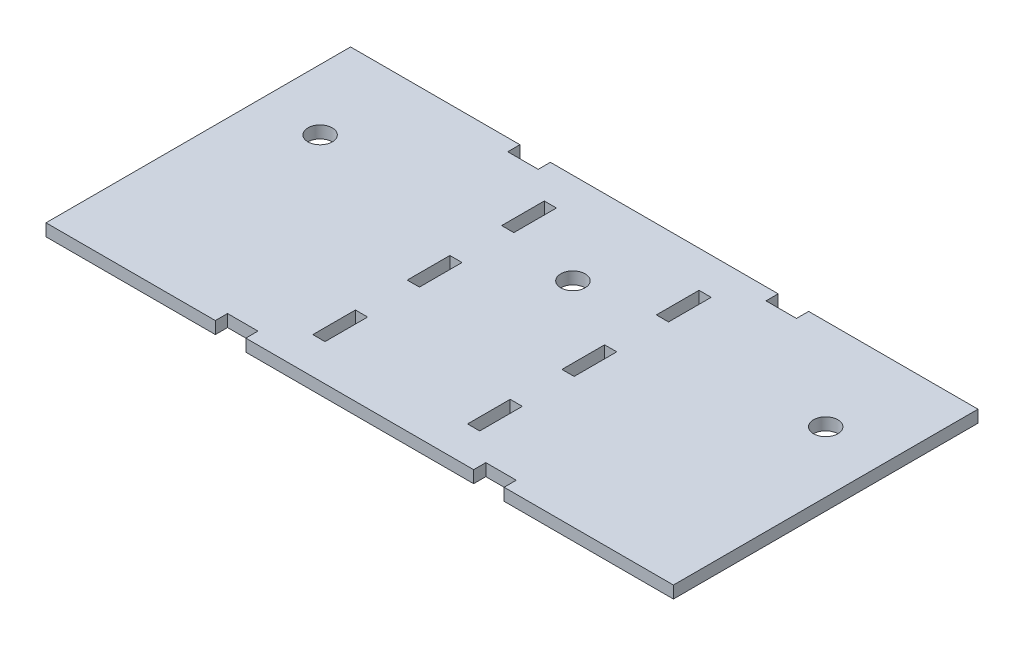
from build123d import *

# Parameters (mm, degrees)
SKETCH1_W           = 2
SKETCH1_H           = 7
SKETCH1_R           = 2
BOSS_EXTRUDE1_DEPTH = 2


with BuildPart() as part:
    # Sketch1 → Boss-Extrude1 (new body)
    with BuildSketch(Plane(origin=(0, 0, 0), x_dir=(1, 0, 0), z_dir=(0, 1, 0))):
        Polygon((-42.999453113, 2.019339096), (-70.799453113, 2.019339096), (-70.799453113, -47.980660904), (-42.999453113, -47.980660904), (-42.999453113, -45.980660904), (-37.999453113, -45.980660904), (-37.999453113, -47.980660904), (-0.599453113, -47.980660904), (-0.599453113, -45.980660904), (4.400546887, -45.980660904), (4.400546887, -47.980660904), (32.200546887, -47.980660904), (32.200546887, 2.019339096), (4.400546887, 2.019339096), (4.400546887, 0.019339096), (-0.599453113, 0.019339096), (-0.599453113, 2.019339096), (-37.999453113, 2.019339096), (-37.999453113, 0.019339096), (-42.999453113, 0.019339096), align=None)
        with Locations((-31.999453113, -38.480660904)):
            Rectangle(SKETCH1_W, SKETCH1_H, mode=Mode.SUBTRACT)
        with Locations((-6.599453113, -38.480660904)):
            Rectangle(SKETCH1_W, SKETCH1_H, mode=Mode.SUBTRACT)
        with Locations(Location((-60.799453113, -12.980660904, 0), (0, 0, 270))):
            Circle(SKETCH1_R, mode=Mode.SUBTRACT)
        with Locations((-31.999453113, -22.980660904)):
            Rectangle(SKETCH1_W, SKETCH1_H, mode=Mode.SUBTRACT)
        with Locations(Location((-19.299453113, -12.980660904, 0), (0, 0, 270))):
            Circle(SKETCH1_R, mode=Mode.SUBTRACT)
        with Locations((-31.999453113, -7.480660904)):
            Rectangle(SKETCH1_W, SKETCH1_H, mode=Mode.SUBTRACT)
        with Locations((-6.599453113, -22.980660904)):
            Rectangle(SKETCH1_W, SKETCH1_H, mode=Mode.SUBTRACT)
        with Locations(Location((22.200546887, -12.980660904, 0), (0, 0, 270))):
            Circle(SKETCH1_R, mode=Mode.SUBTRACT)
        with Locations((-6.599453113, -7.480660904)):
            Rectangle(SKETCH1_W, SKETCH1_H, mode=Mode.SUBTRACT)
    extrude(amount=BOSS_EXTRUDE1_DEPTH)


solid = part.part
